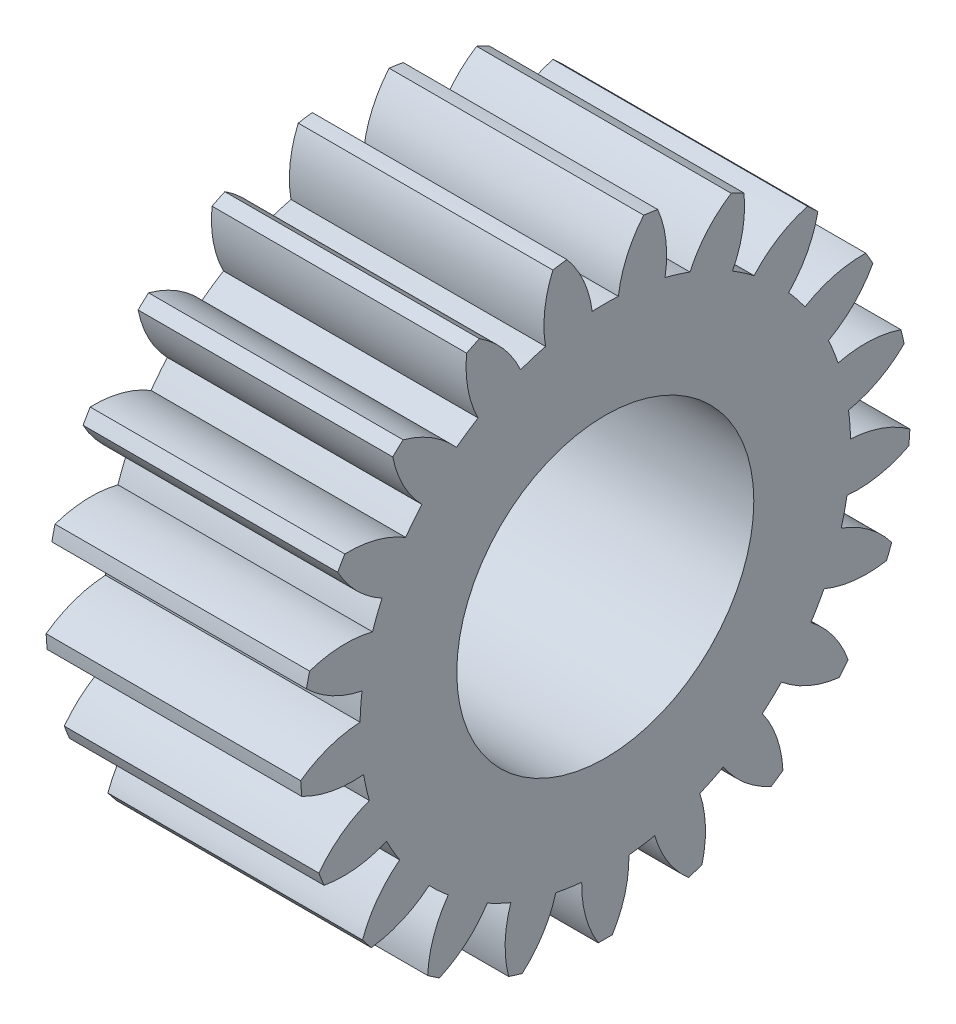
from build123d import *

# Parameters (mm, degrees)
BASPROSKE_W     = 12
BASPROSKE_H     = 14.375
TOOTHCUT_DEPTH  = 24.606805163
TEETHCUTS_COUNT = 21
TEETHCUTS_ANGLE = 342.857142857
BORSKE_R        = 7
BORE_DEPTH      = 50.0000508


with BuildPart() as part:
    # BasProSke → Base-Revolve (revolve)
    with BuildSketch(Plane(origin=(0, 0, 0), x_dir=(1, 0, 0), z_dir=(0, 1, 0)), mode=Mode.PRIVATE) as base_revolve_sk:
        with Locations((6, 7.1875)):
            Rectangle(BASPROSKE_W, BASPROSKE_H)
    revolve(base_revolve_sk.sketch.rotate(Axis((-10, 0, 0), (1, 0, 0)), 180), axis=Axis((-10, 0, 0), (1, 0, 0)))

    # TooCutSke → ToothCut (cut, through all)
    with BuildSketch(Plane(origin=(0, 0, 0), x_dir=(0, 0, -1), z_dir=(1, 0, 0))):
        with BuildLine():
            ThreePointArc((0.615260942, 11.545117419), (0, 11.5615), (-0.615260942, 11.545117419))
            ThreePointArc((-0.615260942, 11.545117419), (-1.023565158, 13.002884474), (-1.830858013, 14.283538746))
            ThreePointArc((-1.830858013, 14.283538746), (0, 14.4004), (1.830858013, 14.283538746))
            ThreePointArc((1.830858013, 14.283538746), (1.023565158, 13.002884474), (0.615260942, 11.545117419))
        make_face()
    toothcut = extrude(amount=TOOTHCUT_DEPTH, mode=Mode.SUBTRACT)

    # TeethCuts: ToothCut ×21 about axis
    teethcuts_axis = Axis((-10, 0, 0), (1, 0, 0))
    for i in range(1, TEETHCUTS_COUNT):
        add(toothcut.rotate(teethcuts_axis, i * TEETHCUTS_ANGLE / (TEETHCUTS_COUNT - 1)), mode=Mode.SUBTRACT)

    # BorSke → Bore (cut, symmetric)
    with BuildSketch(Plane(origin=(0, 0, 0), x_dir=(0, 0, -1), z_dir=(1, 0, 0))):
        with Locations(Location((0, 0, 0), (0, 0, 180))):
            Circle(BORSKE_R)
    extrude(amount=BORE_DEPTH, both=True, mode=Mode.SUBTRACT)


solid = part.part
